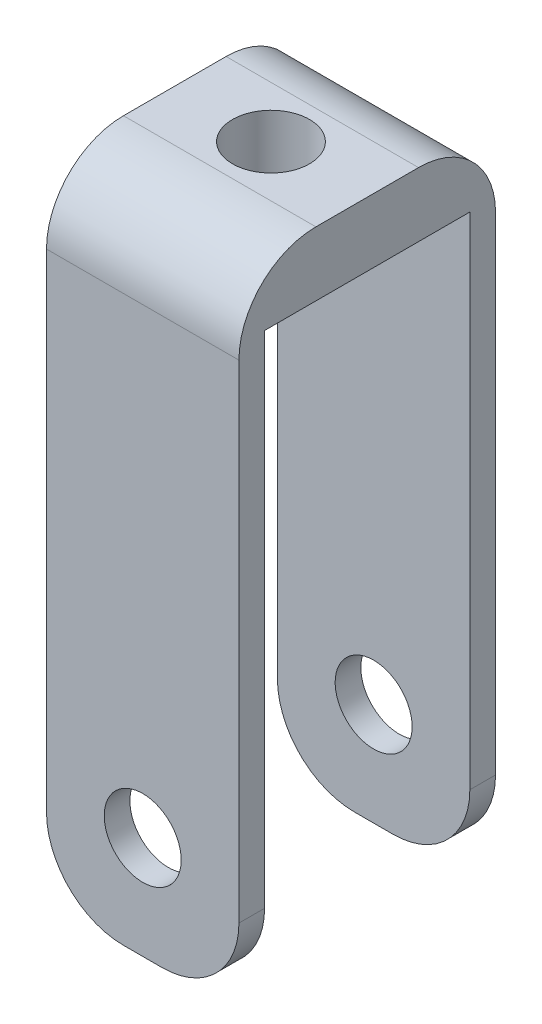
from build123d import *

# Parameters (mm, degrees)
BOSS_EXTRUDE1_DEPTH = 7.5
SKETCH2_R           = 3
CUT_EXTRUDE1_DEPTH  = 15
SKETCH3_R           = 3
CUT_EXTRUDE2_DEPTH  = 55.371407927
FILLET1_R           = 6


with BuildPart() as part:
    # Sketch1 → Boss-Extrude1 (new, symmetric)
    with BuildSketch(Plane(origin=(0, 0, 0), x_dir=(0, 0, -1), z_dir=(1, 0, 0))):
        Polygon((0, 0), (-10, 0), (-10, -50), (-8, -50), (-8, -5), (8, -5), (8, -50), (10, -50), (10, 0), align=None)
    extrude(amount=BOSS_EXTRUDE1_DEPTH, both=True)

    # Sketch2 → Cut-Extrude1 (cut)
    with BuildSketch(Plane(origin=(0, 0, 0), x_dir=(1, 0, 0), z_dir=(0, 1, 0))):
        with Locations(Location((0, 0, 0), (0, 0, 270))):
            Circle(SKETCH2_R)
    extrude(amount=-CUT_EXTRUDE1_DEPTH, mode=Mode.SUBTRACT)

    # Sketch3 → Cut-Extrude2 (cut, through all)
    with BuildSketch(Plane.XY.offset(10)):
        with Locations((0, -42)):
            Circle(SKETCH3_R)
    extrude(amount=-CUT_EXTRUDE2_DEPTH, mode=Mode.SUBTRACT)

    # Fillet1
    fillet1_edges = [part.edges().sort_by_distance(p)[0] for p in [
        (-7.5, -50, 9),
        (0, 0, -10),
        (0, 0, 10),
        (7.5, -50, 9),
        (7.5, -50, -9),
        (-7.5, -50, -9),
    ]]
    fillet(fillet1_edges, radius=FILLET1_R)


solid = part.part
